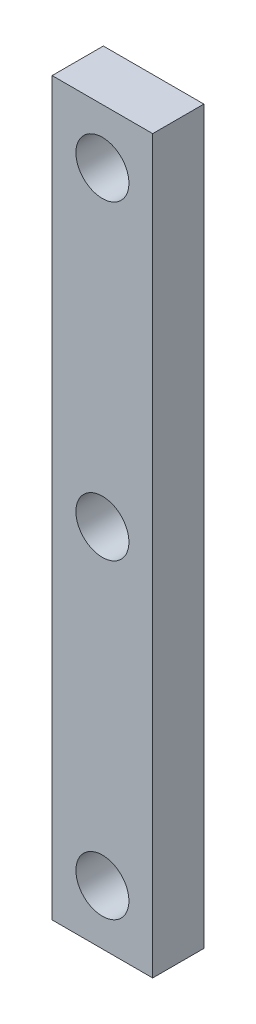
from build123d import *

# Parameters (mm, degrees)
SKETCH1_W              = 5.5
SKETCH1_H              = 2.8
BOSS_EXTRUDE1_DEPTH    = 40
M2_5_CLEARANCE_HOLE1_D = 2.9


with BuildPart() as part:
    # Sketch1 → Boss-Extrude1 (new body)
    with BuildSketch(Plane(origin=(0, 0, 0), x_dir=(1, 0, 0), z_dir=(0, 1, 0))):
        Rectangle(SKETCH1_W, SKETCH1_H)
    extrude(amount=BOSS_EXTRUDE1_DEPTH)

    # M2.5 Clearance Hole1 (through all)
    with Locations(Plane.XY.offset(1.4)):
        with Locations((0, 20), (0, 37), (0, 3)):
            Hole(M2_5_CLEARANCE_HOLE1_D / 2)


solid = part.part
